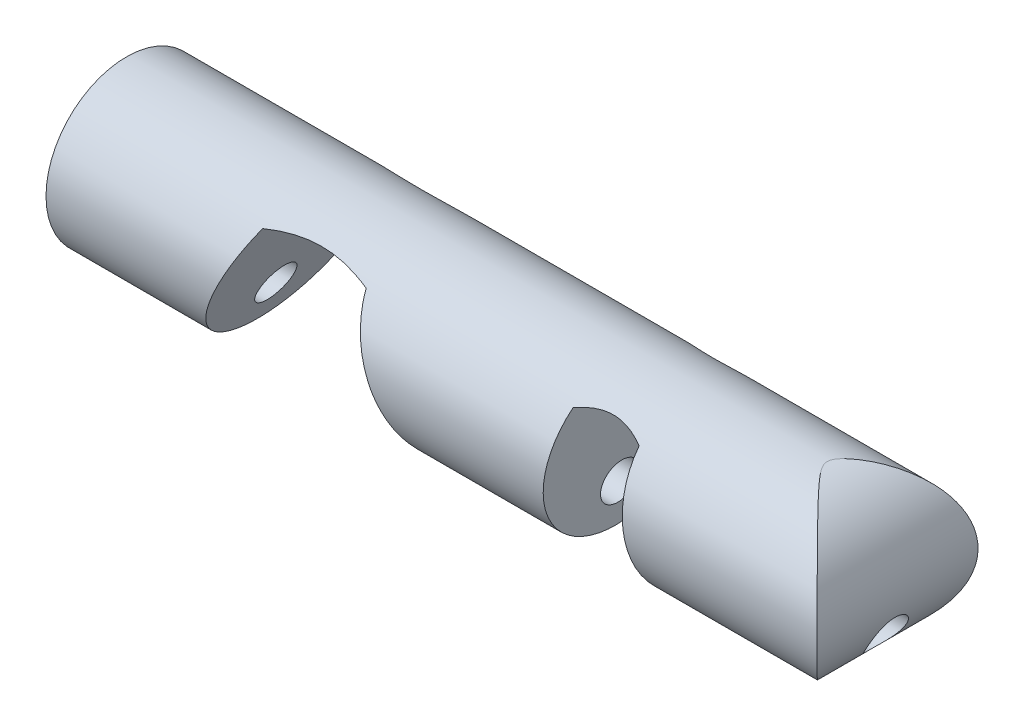
from build123d import *

# Parameters (mm, degrees)
BOSS_EXTRUDE3_DEPTH = 17.52
SKETCH5_OUTSIDE_W   = 37.02
SKETCH5_OUTSIDE_H   = 37.174
SKETCH5_OUTSIDE_R   = 8.755
CUT_EXTRUDE7_DEPTH  = 88.487428942
SKETCH6_R           = 2.100334354
CUT_EXTRUDE8_DEPTH  = 88.46999549


with BuildPart() as part:
    # Sketch1 → Boss-Extrude3 (new body)
    with BuildSketch(Plane.XY):
        with BuildLine():
            Line((0, 0), (14.267245849, 0))
            Line((14.267245849, 0), (21.021041326, 14.94364804))
            ThreePointArc((21.021041326, 14.94364804), (26.648105385, 15.66096006), (32.275169445, 14.94364804))
            Line((32.275169445, 14.94364804), (38.949508505, 0))
            Line((38.949508505, 0), (53.219448236, -0.041473561))
            Line((53.219448236, -0.041473561), (54.782126974, 14.94364804))
            ThreePointArc((54.782126974, 14.94364804), (58.376232217, 15.66096006), (61.97033746, 14.94364804))
            Line((61.97033746, 14.94364804), (63.889508505, 0))
            Line((63.889508505, 0), (73.889508505, 0))
            ThreePointArc((73.889508505, 0), (83.889508505, 8.76), (73.889508505, 17.52))
            Line((73.889508505, 17.52), (0, 17.52))
            Line((0, 17.52), (0, 0))
        make_face()
    extrude(amount=BOSS_EXTRUDE3_DEPTH)

    # Sketch5 outside → Cut-Extrude7 (cut, through all)
    with BuildSketch(Plane.ZY):
        with Locations((8.76, 8.76)):
            Rectangle(SKETCH5_OUTSIDE_W, SKETCH5_OUTSIDE_H)
        with Locations((8.76, 8.76)):
            Circle(SKETCH5_OUTSIDE_R, mode=Mode.SUBTRACT)
    extrude(amount=-CUT_EXTRUDE7_DEPTH, mode=Mode.SUBTRACT)

    # Sketch6 → Cut-Extrude8 (cut, through all)
    with BuildSketch(Plane.ZY):
        with Locations((8.76, 4.385)):
            Circle(SKETCH6_R)
    extrude(amount=-CUT_EXTRUDE8_DEPTH, mode=Mode.SUBTRACT)


solid = part.part
